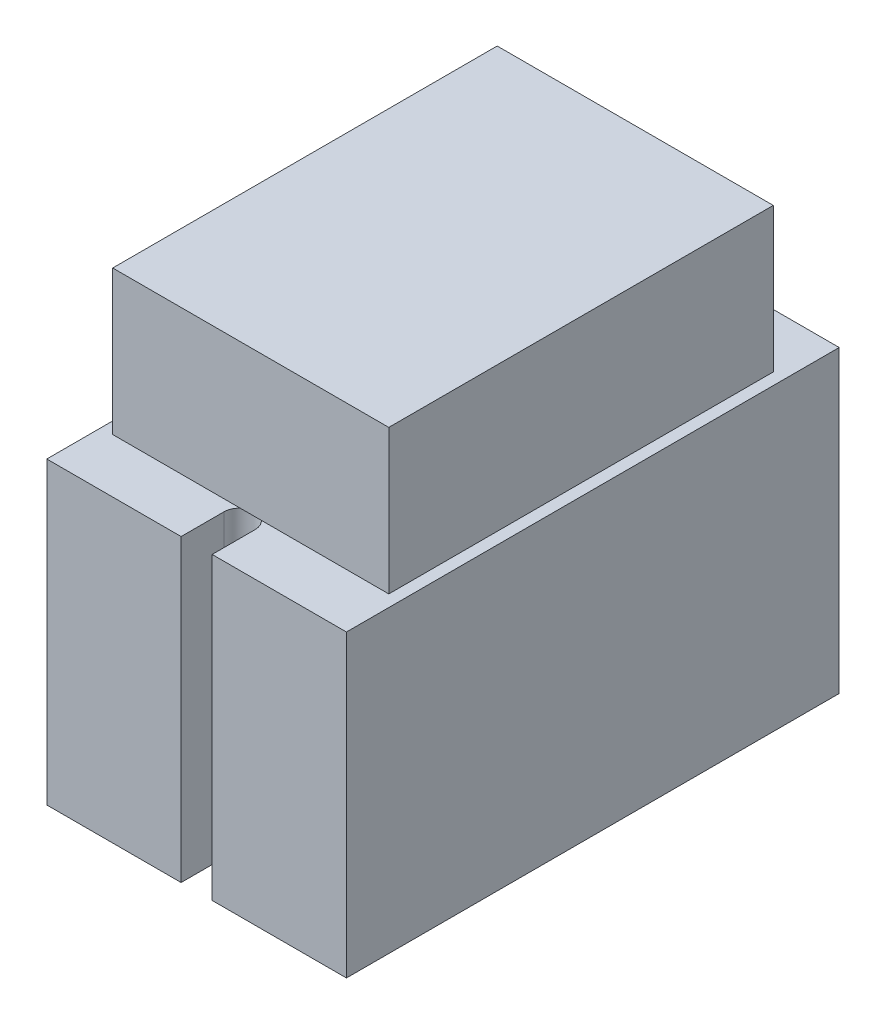
from build123d import *

# Parameters (mm, degrees)
BOSS_EXTRUDE1_DEPTH = 49.0728
SKETCH2_W           = 45.212
SKETCH2_H           = 62.9666
BOSS_EXTRUDE2_DEPTH = 23.622


with BuildPart() as part:
    # Sketch1 → Boss-Extrude1 (new body)
    with BuildSketch(Plane(origin=(0, 0, 0), x_dir=(1, 0, 0), z_dir=(0, 1, 0))):
        with BuildLine():
            Line((0, 80.6958), (0, 0))
            Line((0, 0), (21.9964, 0))
            Line((21.9964, 0), (21.9964, 7.0104))
            ThreePointArc((21.9964, 7.0104), (24.5364, 9.5504), (27.0764, 7.0104))
            Line((27.0764, 7.0104), (27.0764, 0))
            Line((27.0764, 0), (49.0728, 0))
            Line((49.0728, 0), (49.0728, 80.6958))
            Line((49.0728, 80.6958), (27.0764, 80.6958))
            Line((27.0764, 80.6958), (27.0764, 73.6854))
            ThreePointArc((27.0764, 73.6854), (24.5364, 71.1454), (21.9964, 73.6854))
            Line((21.9964, 73.6854), (21.9964, 80.6958))
            Line((21.9964, 80.6958), (0, 80.6958))
        make_face()
    extrude(amount=BOSS_EXTRUDE1_DEPTH)

    # Sketch2 → Boss-Extrude2 (add)
    with BuildSketch(Plane(origin=(0, 49.0728, 0), x_dir=(1, 0, 0), z_dir=(0, 1, 0))):
        with Locations((24.5364, 40.3479)):
            Rectangle(SKETCH2_W, SKETCH2_H)
    extrude(amount=BOSS_EXTRUDE2_DEPTH)


solid = part.part
